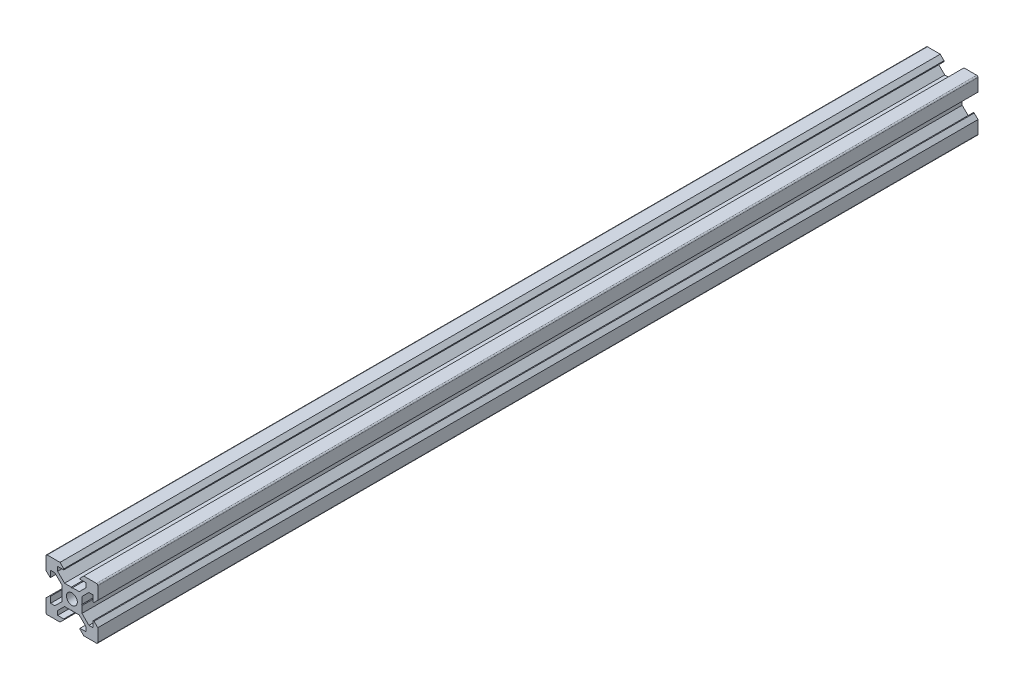
from build123d import *

# Parameters (mm, degrees)
SKETCH1_R           = 2.1
BOSS_EXTRUDE1_DEPTH = 340


with BuildPart() as part:
    # Sketch1 → Boss-Extrude1 (new body)
    with BuildSketch(Plane.XY):
        with BuildLine():
            Line((4.58, -10), (9.5, -10))
            ThreePointArc((9.5, -10), (9.853553391, -9.853553391), (10, -9.5))
            Line((10, -9.5), (10, -4.58))
            Line((10, -4.58), (8.545, -3.125))
            Line((8.545, -3.125), (8.2, -3.125))
            Line((8.2, -3.125), (8.2, -5.5))
            Line((8.2, -5.5), (6.560660172, -5.5))
            Line((6.560660172, -5.5), (3.9, -2.839339828))
            Line((3.9, -2.839339828), (3.9, -0.21))
            Line((3.9, -0.21), (3.69, 0))
            Line((3.69, 0), (3.9, 0.21))
            Line((3.9, 0.21), (3.9, 2.839339828))
            Line((3.9, 2.839339828), (6.560660172, 5.5))
            Line((6.560660172, 5.5), (8.2, 5.5))
            Line((8.2, 5.5), (8.2, 3.125))
            Line((8.2, 3.125), (8.545, 3.125))
            Line((8.545, 3.125), (10, 4.58))
            Line((10, 4.58), (10, 9.5))
            ThreePointArc((10, 9.5), (9.853553391, 9.853553391), (9.5, 10))
            Line((9.5, 10), (4.58, 10))
            Line((4.58, 10), (3.125, 8.545))
            Line((3.125, 8.545), (3.125, 8.2))
            Line((3.125, 8.2), (5.5, 8.2))
            Line((5.5, 8.2), (5.5, 6.560660172))
            Line((5.5, 6.560660172), (2.839339828, 3.9))
            Line((2.839339828, 3.9), (0.21, 3.9))
            Line((0.21, 3.9), (0, 3.69))
            Line((0, 3.69), (-0.21, 3.9))
            Line((-0.21, 3.9), (-2.839339828, 3.9))
            Line((-2.839339828, 3.9), (-5.5, 6.560660172))
            Line((-5.5, 6.560660172), (-5.5, 8.2))
            Line((-5.5, 8.2), (-3.125, 8.2))
            Line((-3.125, 8.2), (-3.125, 8.545))
            Line((-3.125, 8.545), (-4.58, 10))
            Line((-4.58, 10), (-9.5, 10))
            ThreePointArc((-9.5, 10), (-9.853553391, 9.853553391), (-10, 9.5))
            Line((-10, 9.5), (-10, 4.58))
            Line((-10, 4.58), (-8.545, 3.125))
            Line((-8.545, 3.125), (-8.2, 3.125))
            Line((-8.2, 3.125), (-8.2, 5.5))
            Line((-8.2, 5.5), (-6.560660172, 5.5))
            Line((-6.560660172, 5.5), (-3.9, 2.839339828))
            Line((-3.9, 2.839339828), (-3.9, 0.21))
            Line((-3.9, 0.21), (-3.69, 0))
            Line((-3.69, 0), (-3.9, -0.21))
            Line((-3.9, -0.21), (-3.9, -2.839339828))
            Line((-3.9, -2.839339828), (-6.560660172, -5.5))
            Line((-6.560660172, -5.5), (-8.2, -5.5))
            Line((-8.2, -5.5), (-8.2, -3.125))
            Line((-8.2, -3.125), (-8.545, -3.125))
            Line((-8.545, -3.125), (-10, -4.58))
            Line((-10, -4.58), (-10, -9.5))
            ThreePointArc((-10, -9.5), (-9.853553391, -9.853553391), (-9.5, -10))
            Line((-9.5, -10), (-4.58, -10))
            Line((-4.58, -10), (-3.125, -8.545))
            Line((-3.125, -8.545), (-3.125, -8.2))
            Line((-3.125, -8.2), (-5.5, -8.2))
            Line((-5.5, -8.2), (-5.5, -6.560660172))
            Line((-5.5, -6.560660172), (-2.839339828, -3.9))
            Line((-2.839339828, -3.9), (-0.21, -3.9))
            Line((-0.21, -3.9), (0, -3.69))
            Line((0, -3.69), (0.21, -3.9))
            Line((0.21, -3.9), (2.839339828, -3.9))
            Line((2.839339828, -3.9), (5.5, -6.560660172))
            Line((5.5, -6.560660172), (5.5, -8.2))
            Line((5.5, -8.2), (3.125, -8.2))
            Line((3.125, -8.2), (3.125, -8.545))
            Line((3.125, -8.545), (4.58, -10))
        make_face()
        Circle(SKETCH1_R, mode=Mode.SUBTRACT)
    extrude(amount=BOSS_EXTRUDE1_DEPTH)


solid = part.part
